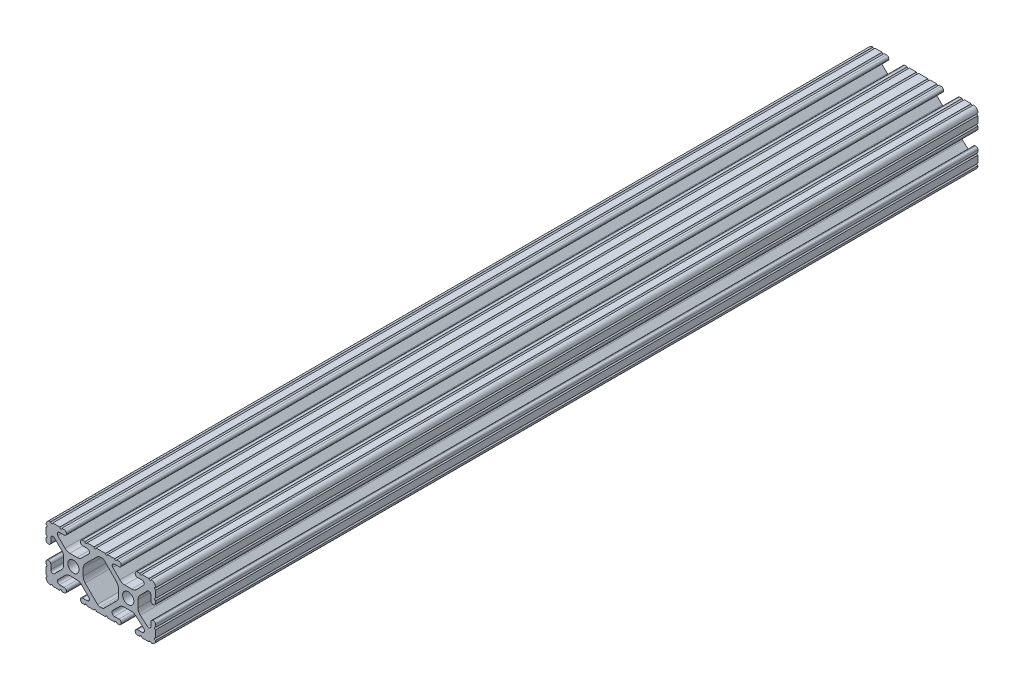
from build123d import *

# Parameters (mm, degrees)
SKETCH1_R           = 2.6035
BOSS_EXTRUDE1_DEPTH = 190.5


with BuildPart() as part:
    # Sketch1 → Boss-Extrude1 (new, symmetric)
    with BuildSketch(Plane.XY):
        with BuildLine():
            Line((18.01710265, 12.7), (16.98745015, 12.7))
            ThreePointArc((16.98745015, 12.7), (16.245730386, 12.392769614), (15.9385, 11.65104985))
            Line((15.9385, 11.65104985), (15.9385, 11.53922))
            ThreePointArc((15.9385, 11.53922), (16.245750844, 10.797450844), (16.98752, 10.4902))
            Line((16.98752, 10.4902), (19.116384363, 10.4902))
            ThreePointArc((19.116384363, 10.4902), (20.052502933, 9.869096983), (19.844087081, 8.765172272))
            Line((19.844087081, 8.765172272), (16.618993479, 5.455112286))
            ThreePointArc((16.618993479, 5.455112286), (15.578994274, 4.745442459), (14.344932584, 4.4958))
            Line((14.344932584, 4.4958), (11.083317835, 4.4958))
            ThreePointArc((11.083317835, 4.4958), (9.854330953, 4.743306833), (8.816955189, 5.447238587))
            Line((8.816955189, 5.447238587), (5.564154119, 8.762652677))
            ThreePointArc((5.564154119, 8.762652677), (5.352591412, 9.867473037), (6.289393385, 10.4902))
            Line((6.289393385, 10.4902), (8.41248, 10.4902))
            ThreePointArc((8.41248, 10.4902), (9.154249156, 10.797450844), (9.4615, 11.53922))
            Line((9.4615, 11.53922), (9.4615, 11.65104985))
            ThreePointArc((9.4615, 11.65104985), (9.154269614, 12.392769614), (8.41254985, 12.7))
            Line((8.41254985, 12.7), (7.38288465, 12.7))
            ThreePointArc((7.38288465, 12.7), (6.87488465, 12.192), (6.36688465, 12.7))
            Line((6.36688465, 12.7), (3.14958095, 12.7))
            ThreePointArc((3.14958095, 12.7), (2.64158095, 12.192), (2.13358095, 12.7))
            Line((2.13358095, 12.7), (-2.13358095, 12.7))
            ThreePointArc((-2.13358095, 12.7), (-2.64158095, 12.192), (-3.14958095, 12.7))
            Line((-3.14958095, 12.7), (-6.36689735, 12.7))
            ThreePointArc((-6.36689735, 12.7), (-6.87489735, 12.192), (-7.38289735, 12.7))
            Line((-7.38289735, 12.7), (-8.41254985, 12.7))
            ThreePointArc((-8.41254985, 12.7), (-9.154269614, 12.392769614), (-9.4615, 11.65104985))
            Line((-9.4615, 11.65104985), (-9.4615, 11.53922))
            ThreePointArc((-9.4615, 11.53922), (-9.154249156, 10.797450844), (-8.41248, 10.4902))
            Line((-8.41248, 10.4902), (-6.283641037, 10.4902))
            ThreePointArc((-6.283641037, 10.4902), (-5.297291557, 9.829633109), (-5.532576693, 8.666071843))
            Line((-5.532576693, 8.666071843), (-8.809985098, 5.416263103))
            ThreePointArc((-8.809985098, 5.416263103), (-9.836720513, 4.734920264), (-11.045536121, 4.4958))
            Line((-11.045536121, 4.4958), (-14.354463879, 4.4958))
            ThreePointArc((-14.354463879, 4.4958), (-15.563279487, 4.734920264), (-16.590014902, 5.416263103))
            Line((-16.590014902, 5.416263103), (-19.867423307, 8.666071843))
            ThreePointArc((-19.867423307, 8.666071843), (-20.102708443, 9.829633109), (-19.116358963, 10.4902))
            Line((-19.116358963, 10.4902), (-16.98752, 10.4902))
            ThreePointArc((-16.98752, 10.4902), (-16.245750844, 10.797450844), (-15.9385, 11.53922))
            Line((-15.9385, 11.53922), (-15.9385, 11.65104985))
            ThreePointArc((-15.9385, 11.65104985), (-16.245730386, 12.392769614), (-16.98745015, 12.7))
            Line((-16.98745015, 12.7), (-18.01711535, 12.7))
            ThreePointArc((-18.01711535, 12.7), (-18.52511535, 12.192), (-19.03311535, 12.7))
            Line((-19.03311535, 12.7), (-22.2504, 12.7))
            ThreePointArc((-22.2504, 12.7), (-22.758323491, 12.192000006), (-23.266399977, 12.699846982))
            ThreePointArc((-23.266399977, 12.699846982), (-24.782522516, 12.082522516), (-25.399846982, 10.566399977))
            ThreePointArc((-25.399846982, 10.566399977), (-24.892000006, 10.058323491), (-25.4, 9.5504))
            Line((-25.4, 9.5504), (-25.4, 6.3330836))
            ThreePointArc((-25.4, 6.3330836), (-24.892, 5.8250836), (-25.4, 5.3170836))
            Line((-25.4, 5.3170836), (-25.4, 4.237520184))
            ThreePointArc((-25.4, 4.237520184), (-25.107393763, 3.531106237), (-24.400979816, 3.2385))
            Line((-24.400979816, 3.2385), (-24.23922, 3.2385))
            ThreePointArc((-24.23922, 3.2385), (-23.497450844, 3.545750844), (-23.1902, 4.28752))
            Line((-23.1902, 4.28752), (-23.1902, 6.334741132))
            ThreePointArc((-23.1902, 6.334741132), (-22.556026952, 7.286023527), (-21.434002553, 7.066535717))
            Line((-21.434002553, 7.066535717), (-18.147950853, 3.808156468))
            ThreePointArc((-18.147950853, 3.808156468), (-17.452759693, 2.774838327), (-17.208501877, 1.553619571))
            Line((-17.208501877, 1.553619571), (-17.208501877, -1.695179196))
            ThreePointArc((-17.208501877, -1.695179196), (-17.450738657, -2.911536421), (-18.140486065, -3.942289578))
            Line((-18.140486065, -3.942289578), (-21.431579576, -7.227386226))
            ThreePointArc((-21.431579576, -7.227386226), (-22.55444896, -7.449940594), (-23.1902, -6.498002195))
            Line((-23.1902, -6.498002195), (-23.1902, -4.28752))
            ThreePointArc((-23.1902, -4.28752), (-23.497450844, -3.545750844), (-24.23922, -3.2385))
            Line((-24.23922, -3.2385), (-24.35098, -3.2385))
            ThreePointArc((-24.35098, -3.2385), (-25.092749156, -3.545750844), (-25.4, -4.28752))
            Line((-25.4, -4.28752), (-25.4, -5.3171344))
            ThreePointArc((-25.4, -5.3171344), (-24.892, -5.8251344), (-25.4, -6.3331344))
            Line((-25.4, -6.3331344), (-25.4, -9.5504))
            ThreePointArc((-25.4, -9.5504), (-24.892000006, -10.058323491), (-25.399846982, -10.566399977))
            ThreePointArc((-25.399846982, -10.566399977), (-24.782522516, -12.082522516), (-23.266399977, -12.699846982))
            ThreePointArc((-23.266399977, -12.699846982), (-22.758323491, -12.192000006), (-22.2504, -12.7))
            Line((-22.2504, -12.7), (-19.03308995, -12.7))
            ThreePointArc((-19.03308995, -12.7), (-18.52508995, -12.192), (-18.01708995, -12.7))
            Line((-18.01708995, -12.7), (-16.9874692, -12.7))
            ThreePointArc((-16.9874692, -12.7), (-16.245700044, -12.392749156), (-15.9384492, -11.65098))
            Line((-15.9384492, -11.65098), (-15.9384492, -11.53922))
            ThreePointArc((-15.9384492, -11.53922), (-16.245700044, -10.797450844), (-16.9874692, -10.4902))
            Line((-16.9874692, -10.4902), (-19.116358963, -10.4902))
            ThreePointArc((-19.116358963, -10.4902), (-20.055197748, -9.862578342), (-19.834124023, -8.755124678))
            Line((-19.834124023, -8.755124678), (-16.49660751, -5.423689618))
            ThreePointArc((-16.49660751, -5.423689618), (-15.467274017, -4.736928798), (-14.253591699, -4.4958))
            Line((-14.253591699, -4.4958), (-11.146408301, -4.4958))
            ThreePointArc((-11.146408301, -4.4958), (-9.932725983, -4.736928798), (-8.90339249, -5.423689618))
            Line((-8.90339249, -5.423689618), (-5.565875977, -8.755124678))
            ThreePointArc((-5.565875977, -8.755124678), (-5.344802252, -9.862578342), (-6.283641037, -10.4902))
            Line((-6.283641037, -10.4902), (-8.4125308, -10.4902))
            ThreePointArc((-8.4125308, -10.4902), (-9.154299956, -10.797450844), (-9.4615508, -11.53922))
            Line((-9.4615508, -11.53922), (-9.4615508, -11.65098))
            ThreePointArc((-9.4615508, -11.65098), (-9.154299956, -12.392749156), (-8.4125308, -12.7))
            Line((-8.4125308, -12.7), (-7.38287195, -12.7))
            ThreePointArc((-7.38287195, -12.7), (-6.87487195, -12.192), (-6.36687195, -12.7))
            Line((-6.36687195, -12.7), (-3.14960635, -12.7))
            ThreePointArc((-3.14960635, -12.7), (-2.64160635, -12.192), (-2.13360635, -12.7))
            Line((-2.13360635, -12.7), (2.13360635, -12.7))
            ThreePointArc((2.13360635, -12.7), (2.64159365, -12.1920127), (3.14958095, -12.7))
            Line((3.14958095, -12.7), (6.36691005, -12.7))
            ThreePointArc((6.36691005, -12.7), (6.87491005, -12.192), (7.38291005, -12.7))
            Line((7.38291005, -12.7), (8.4125308, -12.7))
            ThreePointArc((8.4125308, -12.7), (9.154299956, -12.392749156), (9.4615508, -11.65098))
            Line((9.4615508, -11.65098), (9.4615508, -11.53922))
            ThreePointArc((9.4615508, -11.53922), (9.154299956, -10.797450844), (8.4125308, -10.4902))
            Line((8.4125308, -10.4902), (6.289393385, -10.4902))
            ThreePointArc((6.289393385, -10.4902), (5.231590322, -9.783049717), (5.480677245, -8.535265862))
            Line((5.480677245, -8.535265862), (8.597933595, -5.423689618))
            ThreePointArc((8.597933595, -5.423689618), (9.627267088, -4.736928798), (10.840949406, -4.4958))
            Line((10.840949406, -4.4958), (14.102564155, -4.4958))
            ThreePointArc((14.102564155, -4.4958), (15.215927525, -4.697410182), (16.187895372, -5.276636531))
            Line((16.187895372, -5.276636531), (19.868247549, -8.482246082))
            ThreePointArc((19.868247549, -8.482246082), (20.188435806, -9.746879864), (19.116384363, -10.4902))
            Line((19.116384363, -10.4902), (16.9874692, -10.4902))
            ThreePointArc((16.9874692, -10.4902), (16.245700044, -10.797450844), (15.9384492, -11.53922))
            Line((15.9384492, -11.53922), (15.9384492, -11.65098))
            ThreePointArc((15.9384492, -11.65098), (16.245700044, -12.392749156), (16.9874692, -12.7))
            Line((16.9874692, -12.7), (18.01710265, -12.7))
            ThreePointArc((18.01710265, -12.7), (18.52510265, -12.192), (19.03310265, -12.7))
            Line((19.03310265, -12.7), (22.2504, -12.7))
            ThreePointArc((22.2504, -12.7), (22.758323491, -12.192000006), (23.266399977, -12.699846982))
            ThreePointArc((23.266399977, -12.699846982), (24.782522516, -12.082522516), (25.399846982, -10.566399977))
            ThreePointArc((25.399846982, -10.566399977), (24.892000006, -10.058323492), (25.4, -9.550400001))
            Line((25.4, -9.550400001), (25.4, -6.333083592))
            ThreePointArc((25.4, -6.333083592), (24.892000001, -5.825083593), (25.4, -5.317083593))
            Line((25.4, -5.317083593), (25.4, -4.237520184))
            ThreePointArc((25.4, -4.237520184), (25.107393763, -3.531106237), (24.400979816, -3.2385))
            Line((24.400979816, -3.2385), (24.189220184, -3.2385))
            ThreePointArc((24.189220184, -3.2385), (23.482806237, -3.531106237), (23.1902, -4.237520184))
            Line((23.1902, -4.237520184), (23.1902, -6.155876159))
            ThreePointArc((23.1902, -6.155876159), (22.62232736, -7.038258539), (21.583974541, -6.886926384))
            Line((21.583974541, -6.886926384), (18.29817066, -4.024970844))
            ThreePointArc((18.29817066, -4.024970844), (17.493730985, -2.946044689), (17.208501877, -1.630807374))
            Line((17.208501877, -1.630807374), (17.208501877, 1.630807374))
            ThreePointArc((17.208501877, 1.630807374), (17.442348332, 2.82673414), (18.109440981, 3.846495088))
            Line((18.109440981, 3.846495088), (21.526346532, 7.353420386))
            ThreePointArc((21.526346532, 7.353420386), (22.585896263, 7.574939077), (23.1902, 6.676867167))
            Line((23.1902, 6.676867167), (23.1902, 4.237520184))
            ThreePointArc((23.1902, 4.237520184), (23.482806237, 3.531106237), (24.189220184, 3.2385))
            Line((24.189220184, 3.2385), (24.400979816, 3.2385))
            ThreePointArc((24.400979816, 3.2385), (25.107393763, 3.531106237), (25.4, 4.237520184))
            Line((25.4, 4.237520184), (25.4, 5.3170836))
            ThreePointArc((25.4, 5.3170836), (24.891949193, 5.825134407), (25.4, 6.333185215))
            Line((25.4, 6.333185215), (25.4, 9.550400015))
            ThreePointArc((25.4, 9.550400015), (24.892000013, 10.058323498), (25.399846982, 10.566399977))
            ThreePointArc((25.399846982, 10.566399977), (24.782522516, 12.082522516), (23.266399977, 12.699846982))
            ThreePointArc((23.266399977, 12.699846982), (22.758323491, 12.192000006), (22.2504, 12.7))
            Line((22.2504, 12.7), (19.03310265, 12.7))
            ThreePointArc((19.03310265, 12.7), (18.52510265, 12.192), (18.01710265, 12.7))
        make_face()
        with Locations((-12.7, 0)):
            Circle(SKETCH1_R, mode=Mode.SUBTRACT)
        with Locations((12.7, 0)):
            Circle(SKETCH1_R, mode=Mode.SUBTRACT)
        with BuildLine():
            Line((-7.259513935, -3.869413038), (-1.545748891, -9.572766749))
            ThreePointArc((-1.545748891, -9.572766749), (-1.035199478, -9.913400116), (-0.433213048, -10.033))
            Line((-0.433213048, -10.033), (0.433213048, -10.033))
            ThreePointArc((0.433213048, -10.033), (1.035199478, -9.913400116), (1.545748891, -9.572766749))
            Line((1.545748891, -9.572766749), (7.259513935, -3.869413038))
            ThreePointArc((7.259513935, -3.869413038), (7.949261343, -2.838659881), (8.191498123, -1.622302656))
            Line((8.191498123, -1.622302656), (8.191498123, 1.622302656))
            ThreePointArc((8.191498123, 1.622302656), (7.955573352, 2.823327967), (7.282860769, 3.845864069))
            Line((7.282860769, 3.845864069), (1.675572808, 9.561086461))
            ThreePointArc((1.675572808, 9.561086461), (1.161034429, 9.910236611), (0.551456936, 10.033))
            Line((0.551456936, 10.033), (-0.395199982, 10.033))
            ThreePointArc((-0.395199982, 10.033), (-0.994772524, 9.914396349), (-1.50403329, 9.576450301))
            Line((-1.50403329, 9.576450301), (-7.252049147, 3.876839553))
            ThreePointArc((-7.252049147, 3.876839553), (-7.947240307, 2.843521412), (-8.191498123, 1.622302656))
            Line((-8.191498123, 1.622302656), (-8.191498123, -1.622302656))
            ThreePointArc((-8.191498123, -1.622302656), (-7.949261343, -2.838659881), (-7.259513935, -3.869413038))
        make_face(mode=Mode.SUBTRACT)
    extrude(amount=BOSS_EXTRUDE1_DEPTH, both=True)


solid = part.part
